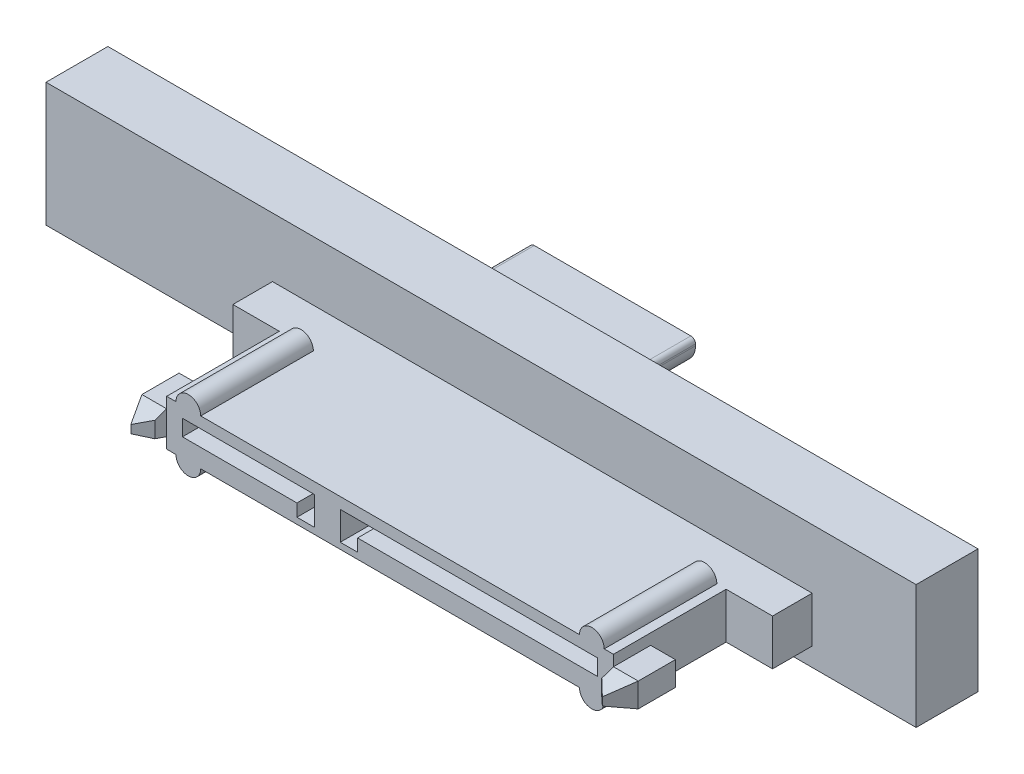
from build123d import *

# Parameters (mm, degrees)
BOSS_EXTRUDE1_DEPTH      = 2.5
BOSS_EXTRUDE1_DEPTH_BACK = 2.5
SKETCH1_W                = 70.3
SKETCH1_H                = 10
SKETCH2_W                = 43.6
SKETCH2_H                = 3.7
BOSS_EXTRUDE2_DEPTH      = 3.2
BOSS_EXTRUDE3_DEPTH      = 9.1
CUT_EXTRUDE1_DEPTH       = 10
BOSS_EXTRUDE4_DEPTH      = 0.975
BOSS_EXTRUDE4_DEPTH_BACK = 0.975
CUT_EXTRUDE2_DEPTH       = 34
CUT_EXTRUDE2_DEPTH_BACK  = 18.975
BOSS_EXTRUDE5_DEPTH      = 5.4


with BuildPart() as part:
    # Sketch1 → Boss-Extrude1 (new, two sides: drawn at the far end of the back side and taken through both)
    with BuildSketch(Plane.XY.offset(-BOSS_EXTRUDE1_DEPTH_BACK)):
        Rectangle(SKETCH1_W, SKETCH1_H)
    extrude(amount=BOSS_EXTRUDE1_DEPTH + BOSS_EXTRUDE1_DEPTH_BACK)

    # Sketch2 → Boss-Extrude2 (add)
    with BuildSketch(Plane.XY.offset(2.5)):
        with Locations((4.95, -1.65)):
            Rectangle(SKETCH2_W, SKETCH2_H)
    extrude(amount=BOSS_EXTRUDE2_DEPTH)

    # Sketch3 → Boss-Extrude3 (add)
    with BuildSketch(Plane.XY.offset(5.7)):
        with BuildLine():
            Line((-13.1, 0.2), (-12.35, 0.2))
            ThreePointArc((-12.35, 0.2), (-11.35, 1.2), (-10.35, 0.2))
            Line((-10.35, 0.2), (20.25, 0.2))
            ThreePointArc((20.25, 0.2), (21.25, 1.2), (22.25, 0.2))
            Line((22.25, 0.2), (23, 0.2))
            Line((23, 0.2), (23, -3.5))
            Line((23, -3.5), (22.25, -3.5))
            ThreePointArc((22.25, -3.5), (21.25, -4.5), (20.25, -3.5))
            Line((20.25, -3.5), (-10.35, -3.5))
            ThreePointArc((-10.35, -3.5), (-11.35, -4.5), (-12.35, -3.5))
            Line((-12.35, -3.5), (-13.1, -3.5))
            Line((-13.1, -3.5), (-13.1, 0.2))
        make_face()
    extrude(amount=BOSS_EXTRUDE3_DEPTH)

    # Sketch4 → Cut-Extrude1 (cut)
    with BuildSketch(Plane.XY.offset(14.8)):
        Polygon((-11.825, -0.7), (-1.175, -0.7), (-1.175, -3), (-2.575, -3), (-2.575, -2), (-11.825, -2), align=None)
        Polygon((0.925, -0.7), (21.725, -0.7), (21.725, -2), (2.325, -2), (2.325, -3), (0.925, -3), align=None)
    extrude(amount=-CUT_EXTRUDE1_DEPTH, mode=Mode.SUBTRACT)

    # Sketch5 → Boss-Extrude4 (add, two sides: drawn at the far end of the back side and taken through both)
    with BuildSketch(Plane(origin=(0, -1.65, 0), x_dir=(1, 0, 0), z_dir=(0, 1, 0)).offset(-BOSS_EXTRUDE4_DEPTH_BACK)):
        Polygon((-13.1, -11.8), (-15.1, -11.8), (-15.1, -14.8), (-14.1, -16.7), (-13.1, -15.75), align=None)
        Polygon((24, -16.7), (25, -14.8), (25, -11.8), (23, -11.8), (23, -15.75), align=None)
    extrude(amount=BOSS_EXTRUDE4_DEPTH + BOSS_EXTRUDE4_DEPTH_BACK)

    # Sketch6 → Cut-Extrude2 (cut, two sides: drawn at the far end of the back side and taken through both)
    with BuildSketch(Plane(origin=(0, 0, 0), x_dir=(0, 0, -1), z_dir=(1, 0, 0)).offset(-CUT_EXTRUDE2_DEPTH_BACK)):
        Polygon((-14.8, -2.625), (-16.7, -1.975), (-16.7, -2.625), align=None)
        Polygon((-16.7, -1.325), (-14.8, -0.675), (-16.7, -0.675), align=None)
    extrude(amount=CUT_EXTRUDE2_DEPTH + CUT_EXTRUDE2_DEPTH_BACK, mode=Mode.SUBTRACT)

    # Sketch7 → Boss-Extrude5 (add)
    with BuildSketch(Plane(origin=(0, 0, -2.5), x_dir=(-1, 0, 0), z_dir=(0, 0, -1))):
        with BuildLine():
            Line((-6.55, 2.9), (6.1, 2.9))
            ThreePointArc((6.1, 2.9), (6.365165043, 2.790165043), (6.475, 2.525))
            Line((6.475, 2.525), (6.475, 0.175))
            ThreePointArc((6.475, 0.175), (6.365165043, -0.090165043), (6.1, -0.2))
            Line((6.1, -0.2), (1.75, -0.2))
            ThreePointArc((1.75, -0.2), (1.484834957, -0.090165043), (1.375, 0.175))
            Line((1.375, 0.175), (1.375, 0.744669914))
            ThreePointArc((1.375, 0.744669914), (1.143506287, 1.091124739), (0.734834957, 1.009834957))
            Line((0.734834957, 1.009834957), (-0.00637085, 0.26862915))
            ThreePointArc((-0.00637085, 0.26862915), (-0.525448208, -0.078207252), (-1.1377417, -0.2))
            Line((-1.1377417, -0.2), (-4.330354687, -0.2))
            ThreePointArc((-4.330354687, -0.2), (-4.942648179, -0.078207252), (-5.461725537, 0.26862915))
            Line((-5.461725537, 0.26862915), (-6.45637085, 1.263274463))
            ThreePointArc((-6.45637085, 1.263274463), (-6.803207252, 1.782351821), (-6.925, 2.394645313))
            Line((-6.925, 2.394645313), (-6.925, 2.525))
            ThreePointArc((-6.925, 2.525), (-6.815165043, 2.790165043), (-6.55, 2.9))
        make_face()
        with BuildLine():
            Line((-5.320304181, 0.410050506), (-6.314949494, 1.404695819))
            ThreePointArc((-6.314949494, 1.404695819), (-6.618431346, 1.858888508), (-6.725, 2.394645313))
            Line((-6.725, 2.394645313), (-6.725, 2.525))
            ThreePointArc((-6.725, 2.525), (-6.673743687, 2.648743687), (-6.55, 2.7))
            Line((-6.55, 2.7), (6.1, 2.7))
            ThreePointArc((6.1, 2.7), (6.223743687, 2.648743687), (6.275, 2.525))
            Line((6.275, 2.525), (6.275, 0.175))
            ThreePointArc((6.275, 0.175), (6.223743687, 0.051256313), (6.1, 0))
            Line((6.1, 0), (1.75, 0))
            ThreePointArc((1.75, 0), (1.626256313, 0.051256313), (1.575, 0.175))
            Line((1.575, 0.175), (1.575, 0.744669914))
            ThreePointArc((1.575, 0.744669914), (1.220042974, 1.275900645), (0.593413601, 1.151256313))
            Line((0.593413601, 1.151256313), (-0.147792206, 0.410050506))
            ThreePointArc((-0.147792206, 0.410050506), (-0.601984894, 0.106568654), (-1.1377417, 0))
            Line((-1.1377417, 0), (-4.330354687, 0))
            ThreePointArc((-4.330354687, 0), (-4.866111492, 0.106568654), (-5.320304181, 0.410050506))
        make_face(mode=Mode.SUBTRACT)
    extrude(amount=BOSS_EXTRUDE5_DEPTH)


solid = part.part
